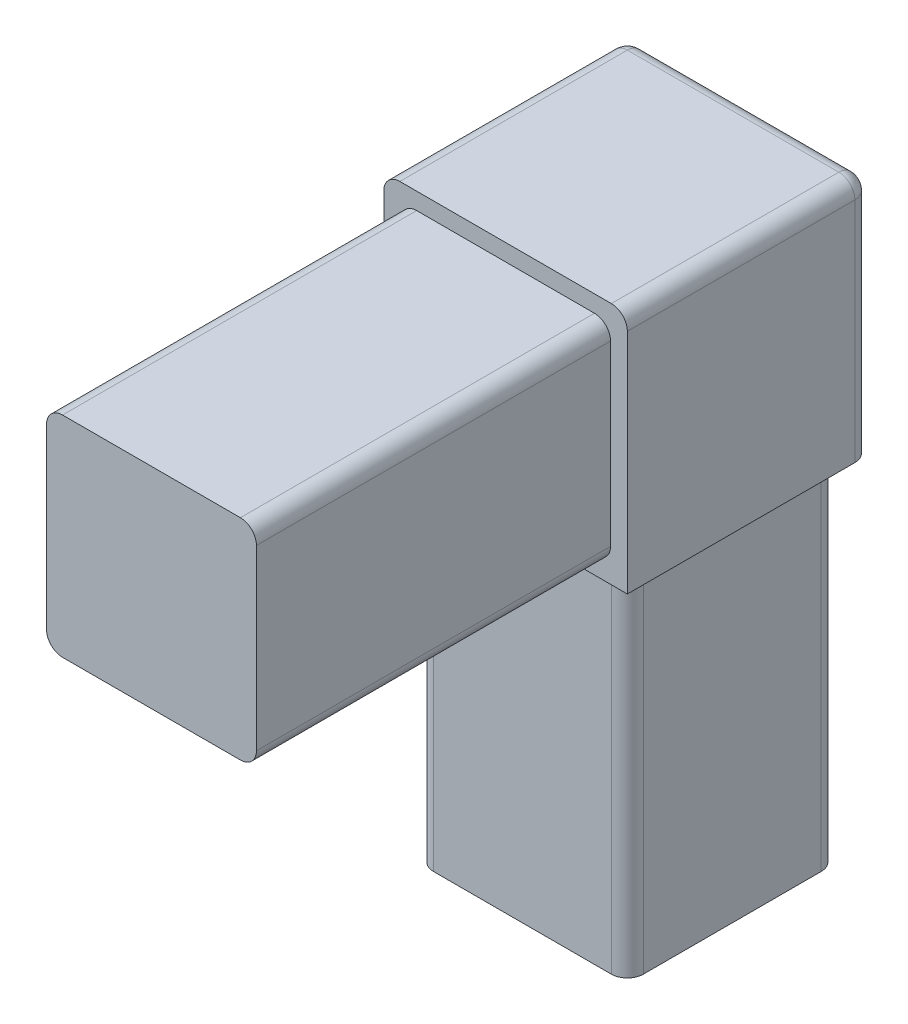
from build123d import *

# Parameters (mm, degrees)
SKETCH1_W           = 16.637
SKETCH1_H           = 16.637
BOSS_EXTRUDE1_DEPTH = 28.067
SKETCH2_W           = 19.304
SKETCH2_H           = 19.304
BOSS_EXTRUDE2_DEPTH = 19.304
SKETCH3_W           = 16.637
SKETCH3_H           = 16.637
BOSS_EXTRUDE3_DEPTH = 28.067
FILLET1_R           = 1.27


with BuildPart() as part:
    # Sketch1 → Boss-Extrude1 (new body)
    with BuildSketch(Plane(origin=(0, 0, 0), x_dir=(1, 0, 0), z_dir=(0, 1, 0))):
        Rectangle(SKETCH1_W, SKETCH1_H)
    extrude(amount=BOSS_EXTRUDE1_DEPTH)

    # Sketch2 → Boss-Extrude2 (add)
    with BuildSketch(Plane(origin=(0, 28.067, 0), x_dir=(1, 0, 0), z_dir=(0, 1, 0))):
        Rectangle(SKETCH2_W, SKETCH2_H)
    extrude(amount=BOSS_EXTRUDE2_DEPTH)

    # Sketch3 → Boss-Extrude3 (add)
    with BuildSketch(Plane.XY.offset(9.652)):
        with Locations((0, 37.719)):
            Rectangle(SKETCH3_W, SKETCH3_H)
    extrude(amount=BOSS_EXTRUDE3_DEPTH)

    # Fillet1
    fillet1_edges = [part.edges().sort_by_distance(p)[0] for p in [
        (9.652, 37.719, -9.652),
        (-9.652, 37.719, -9.652),
        (9.652, 47.371, 0),
        (0, 47.371, -9.652),
        (-9.652, 47.371, 0),
        (8.3185, 29.4005, 23.6855),
        (8.3185, 46.0375, 23.6855),
        (-8.3185, 46.0375, 23.6855),
        (-8.3185, 29.4005, 23.6855),
        (8.3185, 14.0335, 8.3185),
        (-8.3185, 14.0335, 8.3185),
        (-8.3185, 14.0335, -8.3185),
        (8.3185, 14.0335, -8.3185),
    ]]
    fillet(fillet1_edges, radius=FILLET1_R)


solid = part.part
